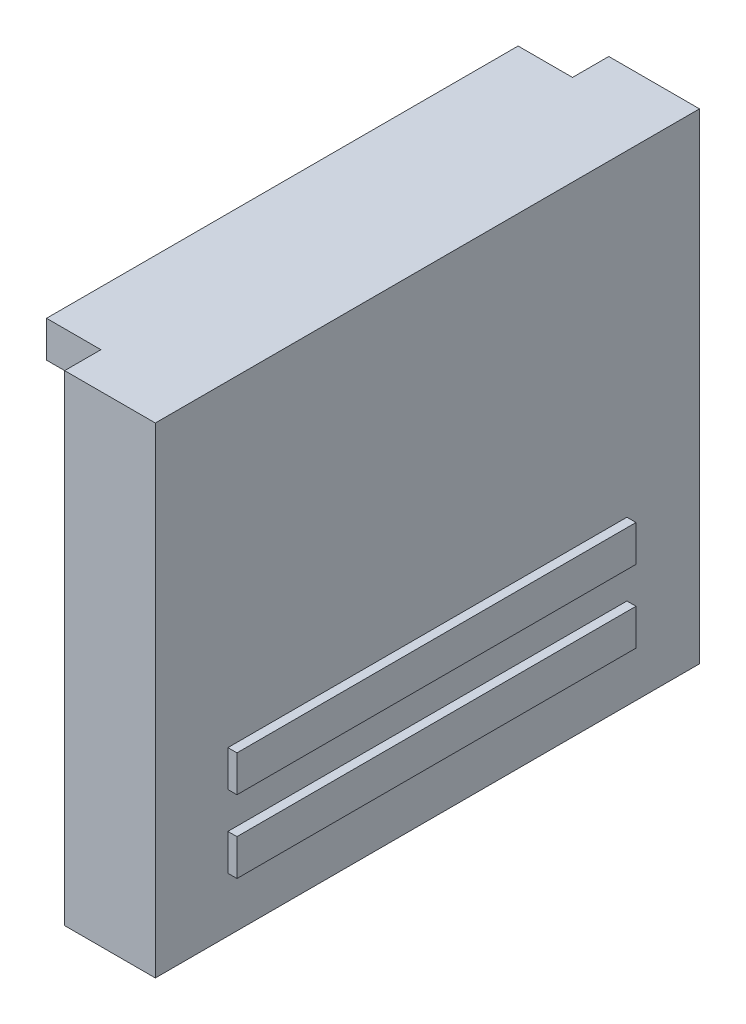
from build123d import *

# Parameters (mm, degrees)
SKETCH1_W           = 30
SKETCH1_H           = 26.5
BOSS_EXTRUDE1_DEPTH = 2.5
SKETCH2_W           = 22
SKETCH2_H           = 2
BOSS_EXTRUDE2_DEPTH = 0.5
SKETCH3_W           = 26
SKETCH3_H           = 2
BOSS_EXTRUDE3_DEPTH = 1.5
SKETCH4_R           = 2
BOSS_EXTRUDE4_DEPTH = 2.5


with BuildPart() as part:
    # Sketch1 → Boss-Extrude1 (new, symmetric)
    with BuildSketch(Plane(origin=(179.150792305, 0, 0), x_dir=(0, 0, -1), z_dir=(1, 0, 0))):
        with Locations((-149, 50.25)):
            Rectangle(SKETCH1_W, SKETCH1_H)
    extrude(amount=BOSS_EXTRUDE1_DEPTH, both=True)

    # Sketch2 → Boss-Extrude2 (add, symmetric)
    with BuildSketch(Plane(origin=(181.650792305, 0, 0), x_dir=(0, 0, -1), z_dir=(1, 0, 0))):
        with Locations((-149, 41)):
            Rectangle(SKETCH2_W, SKETCH2_H)
        with Locations((-149, 45)):
            Rectangle(SKETCH2_W, SKETCH2_H)
    extrude(amount=BOSS_EXTRUDE2_DEPTH, both=True)

    # Sketch3 → Boss-Extrude3 (add, symmetric)
    with BuildSketch(Plane(origin=(175.150792305, 0, 0), x_dir=(0, 0, -1), z_dir=(1, 0, 0))):
        with Locations((-149, 62.5)):
            Rectangle(SKETCH3_W, SKETCH3_H)
    extrude(amount=BOSS_EXTRUDE3_DEPTH, both=True)

    # Sketch4 → Boss-Extrude4 (add, symmetric)
    with BuildSketch(Plane(origin=(174.150792305, 0, 0), x_dir=(0, 0, -1), z_dir=(1, 0, 0))):
        with Locations((-149, 43)):
            Circle(SKETCH4_R)
    extrude(amount=BOSS_EXTRUDE4_DEPTH, both=True)


solid = part.part
